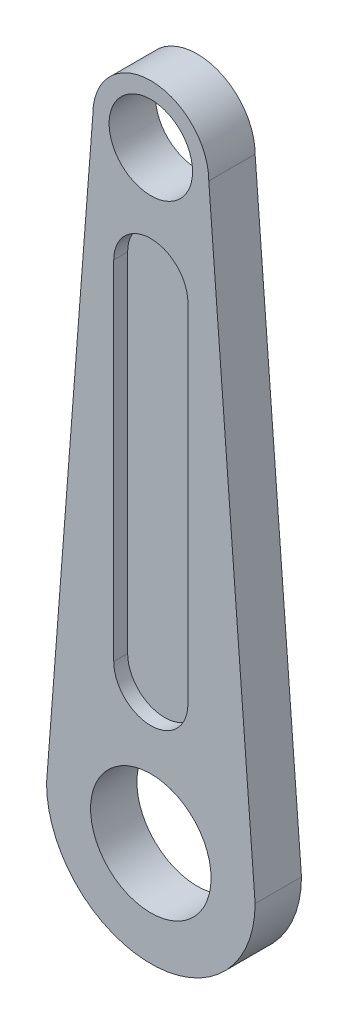
from build123d import *

# Parameters (mm, degrees)
SKETCH1_R           = 13
SKETCH1_R_2         = 9
BOSS_EXTRUDE1_DEPTH = 5
CUT_EXTRUDE1_DEPTH  = 3


with BuildPart() as part:
    # Sketch1 → Boss-Extrude1 (new, symmetric)
    with BuildSketch(Plane.XY):
        with BuildLine():
            ThreePointArc((12.5, 130), (0, 142.5), (-12.5, 130))
            Line((-12.5, 130), (-22.235294118, 3.441176471))
            Line((-22.235294118, 3.441176471), (-22.5, 0))
            ThreePointArc((-22.5, 0), (0, -22.5), (22.5, 0))
            Line((22.5, 0), (22.235294118, 3.441176471))
            Line((22.235294118, 3.441176471), (12.5, 130))
        make_face()
        Circle(SKETCH1_R, mode=Mode.SUBTRACT)
        with Locations((0, 130)):
            Circle(SKETCH1_R_2, mode=Mode.SUBTRACT)
    extrude(amount=BOSS_EXTRUDE1_DEPTH, both=True)

    # Sketch2 → Cut-Extrude1 (cut)
    with BuildSketch(Plane.XY.offset(5)):
        with BuildLine():
            Line((8, 105), (8, 30))
            ThreePointArc((8, 30), (0, 22), (-8, 30))
            Line((-8, 30), (-8, 105))
            ThreePointArc((-8, 105), (0, 113), (8, 105))
        make_face()
    cut_extrude1 = extrude(amount=-CUT_EXTRUDE1_DEPTH, mode=Mode.SUBTRACT)

    # Mirror1: Cut-Extrude1 across plane
    add(cut_extrude1.mirror(Plane.XY), mode=Mode.SUBTRACT)


solid = part.part
